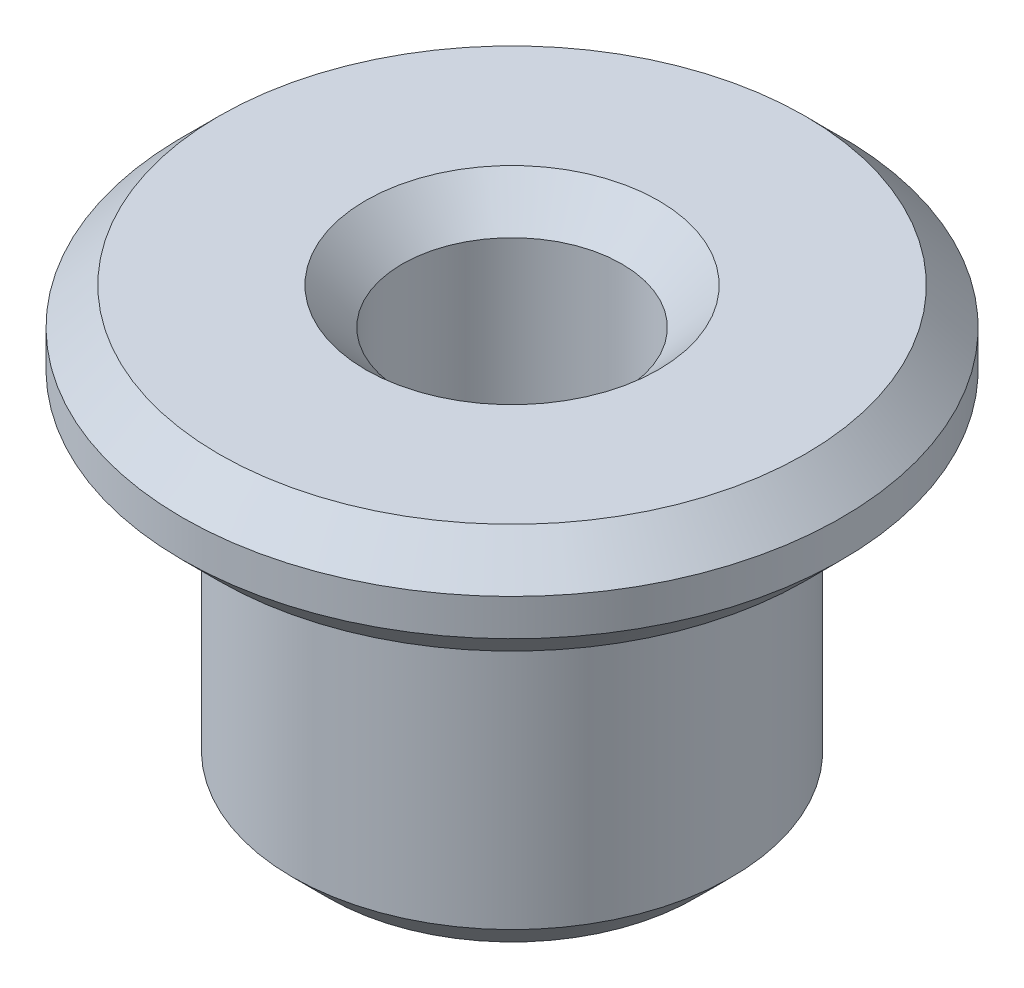
from build123d import *


with BuildPart() as part:
    # Esquisse1 → Révolution1 (revolve)
    with BuildSketch(Plane.XY, mode=Mode.PRIVATE) as r_volution1_sk:
        with BuildLine():
            Line((2, 0), (4, 0))
            Line((4, 0), (4.5, -0.5))
            Line((4.5, -0.5), (4.5, -1))
            Line((4.5, -1), (4, -1.5))
            Line((4, -1.5), (3.5, -1.5))
            ThreePointArc((3.5, -1.5), (3.146446609, -1.646446609), (3, -2))
            Line((3, -2), (3, -5.5))
            Line((3, -5.5), (2.5, -6))
            Line((2.5, -6), (2, -6))
            Line((2, -6), (1.5, -5.5))
            Line((1.5, -5.5), (1.5, -0.5))
            Line((1.5, -0.5), (2, 0))
        make_face()
    revolve(r_volution1_sk.sketch.rotate(Axis((0, 0, 0), (0, -1, 0)), 90), axis=Axis((0, 0, 0), (0, -1, 0)))


solid = part.part
